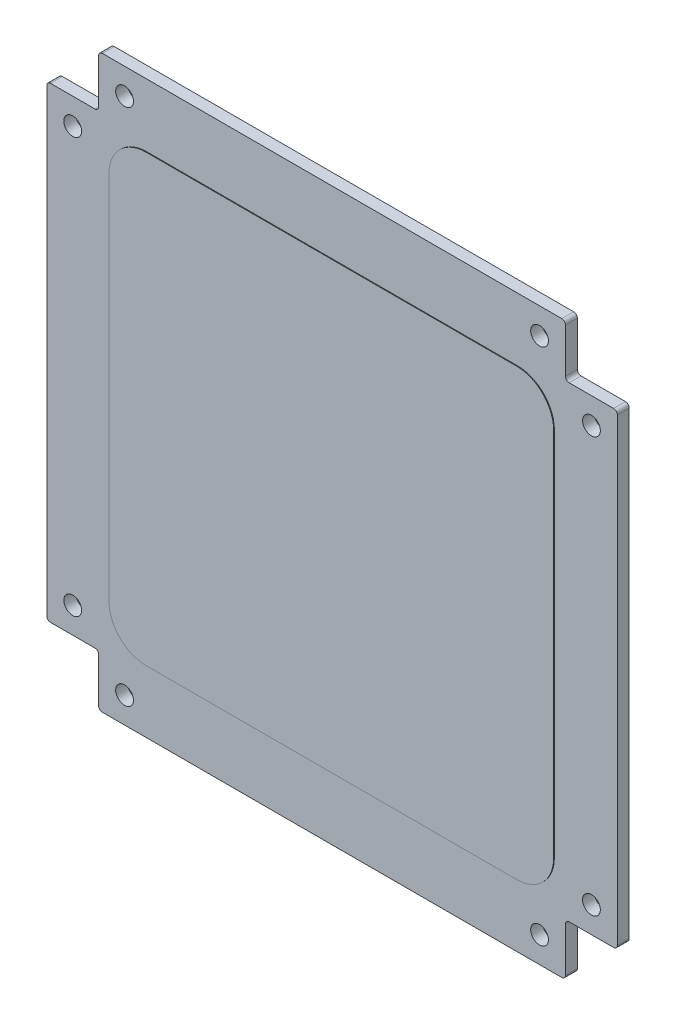
from build123d import *

# Parameters (mm, degrees)
BOSS_EXTRUDE1_DEPTH            = 1.6
BOSS_EXTRUDE2_DEPTH            = 0.1
M2_HOLE1_FIXINGSTRUCTURE_D     = 2.4
M2_HOLE1_FIXINGSTRUCTURE_DEPTH = 200
M2_HOLE1_FIXINGSTRUCTURE_TIP   = 0.721032743


with BuildPart() as part:
    # Sketch1 → Boss-Extrude1 (new body)
    with BuildSketch(Plane.XY):
        with BuildLine():
            Line((-31.5, 38), (-31.5, 32))
            ThreePointArc((-31.5, 32), (-31.646446609, 31.646446609), (-32, 31.5))
            Line((-32, 31.5), (-38, 31.5))
            ThreePointArc((-38, 31.5), (-38.353553391, 31.353553391), (-38.5, 31))
            Line((-38.5, 31), (-38.5, -31))
            ThreePointArc((-38.5, -31), (-38.353553391, -31.353553391), (-38, -31.5))
            Line((-38, -31.5), (-32, -31.5))
            ThreePointArc((-32, -31.5), (-31.646446609, -31.646446609), (-31.5, -32))
            Line((-31.5, -32), (-31.5, -38))
            ThreePointArc((-31.5, -38), (-31.353553391, -38.353553391), (-31, -38.5))
            Line((-31, -38.5), (31, -38.5))
            ThreePointArc((31, -38.5), (31.353553391, -38.353553391), (31.5, -38))
            Line((31.5, -38), (31.5, -32))
            ThreePointArc((31.5, -32), (31.646446609, -31.646446609), (32, -31.5))
            Line((32, -31.5), (38, -31.5))
            ThreePointArc((38, -31.5), (38.353553391, -31.353553391), (38.5, -31))
            Line((38.5, -31), (38.5, 31))
            ThreePointArc((38.5, 31), (38.353553391, 31.353553391), (38, 31.5))
            Line((38, 31.5), (32, 31.5))
            ThreePointArc((32, 31.5), (31.646446609, 31.646446609), (31.5, 32))
            Line((31.5, 32), (31.5, 38))
            ThreePointArc((31.5, 38), (31.353553391, 38.353553391), (31, 38.5))
            Line((31, 38.5), (-31, 38.5))
            ThreePointArc((-31, 38.5), (-31.353553391, 38.353553391), (-31.5, 38))
        make_face()
    extrude(amount=BOSS_EXTRUDE1_DEPTH)

    # Esboço1 → Boss-Extrude2 (add)
    with BuildSketch(Plane.XY.offset(1.6)):
        with BuildLine():
            Line((-25, -30), (25, -30))
            ThreePointArc((25, -30), (28.535533906, -28.535533906), (30, -25))
            Line((30, -25), (30, 25))
            ThreePointArc((30, 25), (28.535533906, 28.535533906), (25, 30))
            Line((25, 30), (-25, 30))
            ThreePointArc((-25, 30), (-28.535533906, 28.535533906), (-30, 25))
            Line((-30, 25), (-30, -25))
            ThreePointArc((-30, -25), (-28.535533906, -28.535533906), (-25, -30))
        make_face()
    extrude(amount=BOSS_EXTRUDE2_DEPTH)

    # M2 Hole1-FixingStructure
    with Locations(Plane(origin=(0, 0, 0), x_dir=(-1, 0, 0), z_dir=(0, 0, -1))):
        with Locations((-28, 35), (28, 35), (-28, -35), (28, -35), (35, 28), (35, -28), (-35, -28), (-35, 28)):
            Hole(M2_HOLE1_FIXINGSTRUCTURE_D / 2, depth=M2_HOLE1_FIXINGSTRUCTURE_DEPTH)
            with Locations((0, 0, -(M2_HOLE1_FIXINGSTRUCTURE_DEPTH + M2_HOLE1_FIXINGSTRUCTURE_TIP / 2))):  # 118° drill point
                Cone(0, M2_HOLE1_FIXINGSTRUCTURE_D / 2, M2_HOLE1_FIXINGSTRUCTURE_TIP, mode=Mode.SUBTRACT)


solid = part.part
